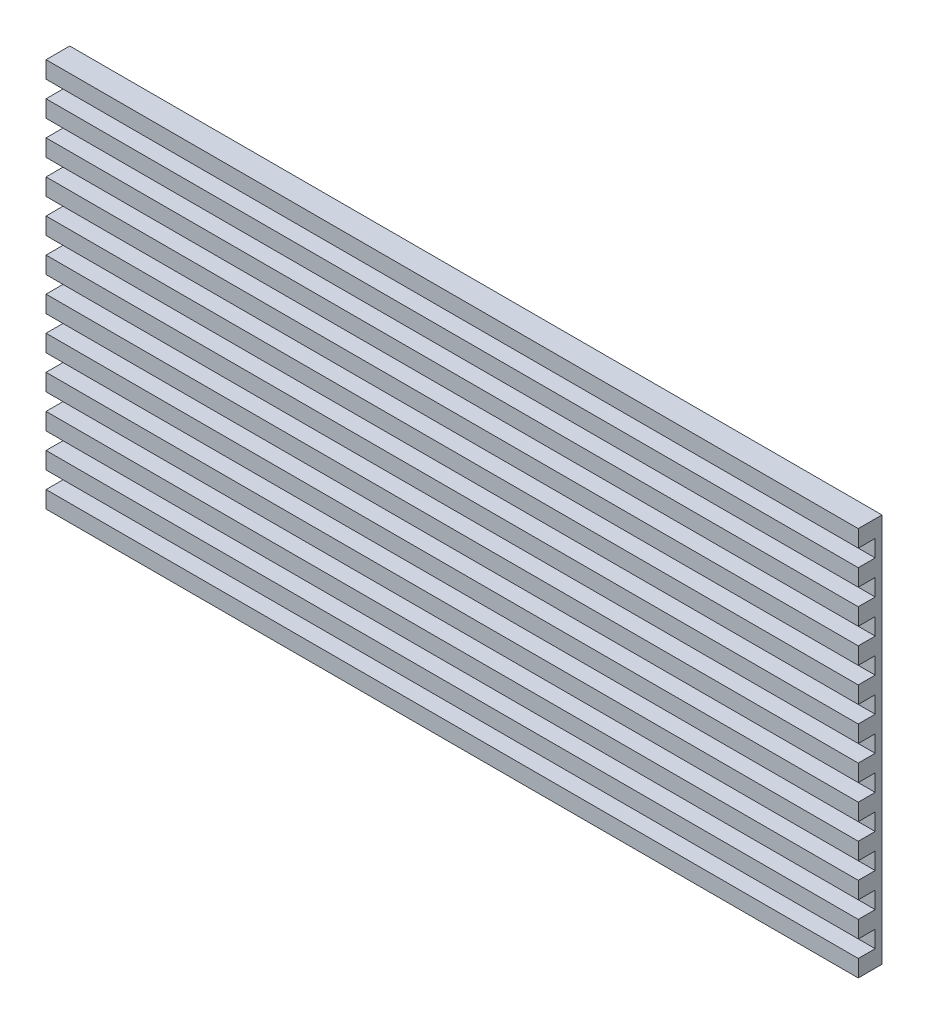
from build123d import *

# Parameters (mm, degrees)
SKETCH_1_W             = 2400
SKETCH_1_H             = 1150
EXTRUDE_1_DEPTH        = 20
SKETCH_2_W             = 2400
SKETCH_2_H             = 50
EXTRUDE_2_DEPTH        = 50
PATTERN_LINEAR_1_COUNT = 12
PATTERN_LINEAR_1_PITCH = 100


with BuildPart() as part:
    # Эскиз1 → Бобышка-Вытянуть1 (new body)
    with BuildSketch(Plane.XY):
        with Locations((1200, 575)):
            Rectangle(SKETCH_1_W, SKETCH_1_H)
    extrude(amount=EXTRUDE_1_DEPTH)

    # Эскиз2 → Бобышка-Вытянуть2 (add)
    with BuildSketch(Plane.XY.offset(20)):
        with Locations((1200, 1125)):
            Rectangle(SKETCH_2_W, SKETCH_2_H)
    extrude_2 = extrude(amount=EXTRUDE_2_DEPTH)

    # Линейный массив1: Бобышка-Вытянуть2 ×12
    with Locations(*[(0, -i * PATTERN_LINEAR_1_PITCH, 0) for i in range(1, PATTERN_LINEAR_1_COUNT)]):
        add(extrude_2)


solid = part.part
